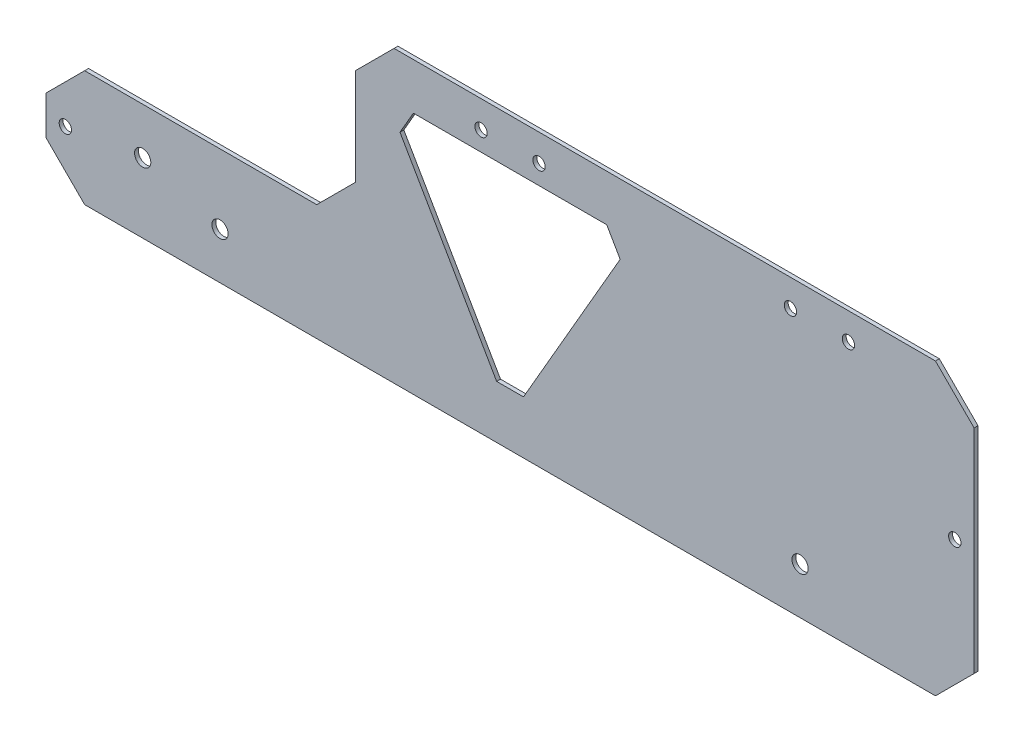
from build123d import *

# Parameters (mm, degrees)
SKETCH_1_W          = 240
SKETCH_1_H          = 75
EXTRUDE_1_DEPTH     = 1
CUT_EXTRUDE_2_DEPTH = 10
SKETCH_4_W          = 80
SKETCH_4_H          = 45
CUT_EXTRUDE_3_DEPTH = 10
CHAMFER_1_SIZE      = 10
SKETCH_5_R          = 1.6
SKETCH_5_R_2        = 2.1
CUT_EXTRUDE_4_DEPTH = 10
EXTRUDE_2_DEPTH     = 1


with BuildPart() as part:
    # 草图1 → 凸台-拉伸1 (new body)
    with BuildSketch(Plane.XY):
        with Locations((120, 37.5)):
            Rectangle(SKETCH_1_W, SKETCH_1_H)
    extrude(amount=EXTRUDE_1_DEPTH)

    # 草图3 → 切除-拉伸2 (cut)
    with BuildSketch(Plane(origin=(0, 0, 0), x_dir=(-1, 0, 0), z_dir=(0, 0, -1))):
        Polygon((-130, 7.679491924), (-110, 7.679491924), (-100, 25), (-110, 42.320508076), (-130, 42.320508076), (-140, 25), align=None)
        Polygon((-148.469655115, 56.990381057), (-135, 33.660254038), (-130, 42.320508076), (-110, 42.320508076), (-105, 33.660254038), (-91.530344885, 56.990381057), (-95, 63), (-145, 63), align=None)
    extrude(amount=-CUT_EXTRUDE_2_DEPTH, mode=Mode.SUBTRACT)

    # 草图4 → 切除-拉伸3 (cut)
    with BuildSketch(Plane(origin=(0, 0, 0), x_dir=(-1, 0, 0), z_dir=(0, 0, -1))):
        with Locations((-40, 52.5)):
            Rectangle(SKETCH_4_W, SKETCH_4_H)
    extrude(amount=-CUT_EXTRUDE_3_DEPTH, mode=Mode.SUBTRACT)

    # 倒角1
    chamfer_1_edges = [part.edges().sort_by_distance(p)[0] for p in [
        (80, 75, 0.5),
        (0, 30, 0.5),
        (80, 30, 0.5),
        (240, 75, 0.5),
        (240, 0, 0.5),
        (0, 0, 0.5),
    ]]
    chamfer(chamfer_1_edges, length=CHAMFER_1_SIZE)

    # 草图5 → 切除-拉伸4 (cut)
    with BuildSketch(Plane(origin=(0, 0, 0), x_dir=(-1, 0, 0), z_dir=(0, 0, -1))):
        with Locations((-5, 15)):
            Circle(SKETCH_5_R)
        with Locations((-195, 12)):
            Circle(SKETCH_5_R_2)
        with Locations((-45, 12)):
            Circle(SKETCH_5_R_2)
        with Locations((-235, 37.5)):
            Circle(SKETCH_5_R)
        with Locations((-207.5, 68)):
            Circle(SKETCH_5_R)
        with Locations((-192.5, 68)):
            Circle(SKETCH_5_R)
        with Locations((-127.5, 68)):
            Circle(SKETCH_5_R)
        with Locations((-112.5, 68)):
            Circle(SKETCH_5_R)
        with Locations((-25, 18)):
            Circle(SKETCH_5_R_2)
    extrude(amount=-CUT_EXTRUDE_4_DEPTH, mode=Mode.SUBTRACT)

    # 草图6 → 凸台-拉伸2 (add)
    with BuildSketch(Plane(origin=(0, 0, 0), x_dir=(-1, 0, 0), z_dir=(0, 0, -1))):
        Polygon((-135, 33.660254038), (-123.469655115, 13.689110868), (-116.530344885, 13.689110868), (-105, 33.660254038), (-100, 25), (-110, 7.679491924), (-130, 7.679491924), (-140, 25), align=None)
    extrude(amount=-EXTRUDE_2_DEPTH)


solid = part.part
